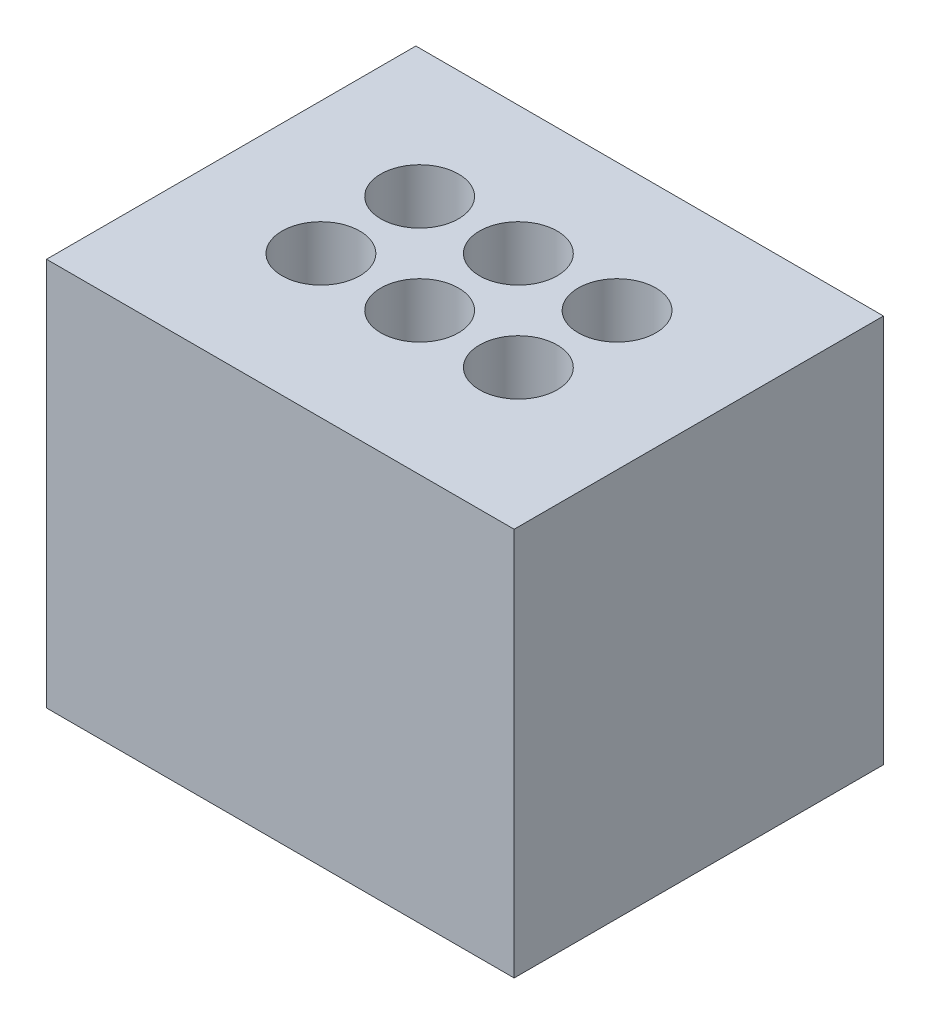
from build123d import *

# Parameters (mm, degrees)
SKETCH1_W           = 12.031940199
SKETCH1_H           = 9.50304057
SKETCH1_R           = 1
BOSS_EXTRUDE1_DEPTH = 10


with BuildPart() as part:
    # Sketch1 → Boss-Extrude1 (new body)
    with BuildSketch(Plane(origin=(0, 0, 0), x_dir=(1, 0, 0), z_dir=(0, 1, 0))):
        with Locations((17.896268666, 11.478156572)):
            Rectangle(SKETCH1_W, SKETCH1_H)
        with Locations(Location((15.280855677, 10.386591101, 0), (0, 0, 270))):
            Circle(SKETCH1_R, mode=Mode.SUBTRACT)
        with Locations(Location((17.820855677, 10.386591101, 0), (0, 0, 270))):
            Circle(SKETCH1_R, mode=Mode.SUBTRACT)
        with Locations(Location((20.360855677, 10.386591101, 0), (0, 0, 270))):
            Circle(SKETCH1_R, mode=Mode.SUBTRACT)
        with Locations(Location((15.280855677, 12.926591101, 0), (0, 0, 270))):
            Circle(SKETCH1_R, mode=Mode.SUBTRACT)
        with Locations(Location((17.820855677, 12.926591101, 0), (0, 0, 270))):
            Circle(SKETCH1_R, mode=Mode.SUBTRACT)
        with Locations(Location((20.360855677, 12.926591101, 0), (0, 0, 270))):
            Circle(SKETCH1_R, mode=Mode.SUBTRACT)
    extrude(amount=BOSS_EXTRUDE1_DEPTH)


solid = part.part
